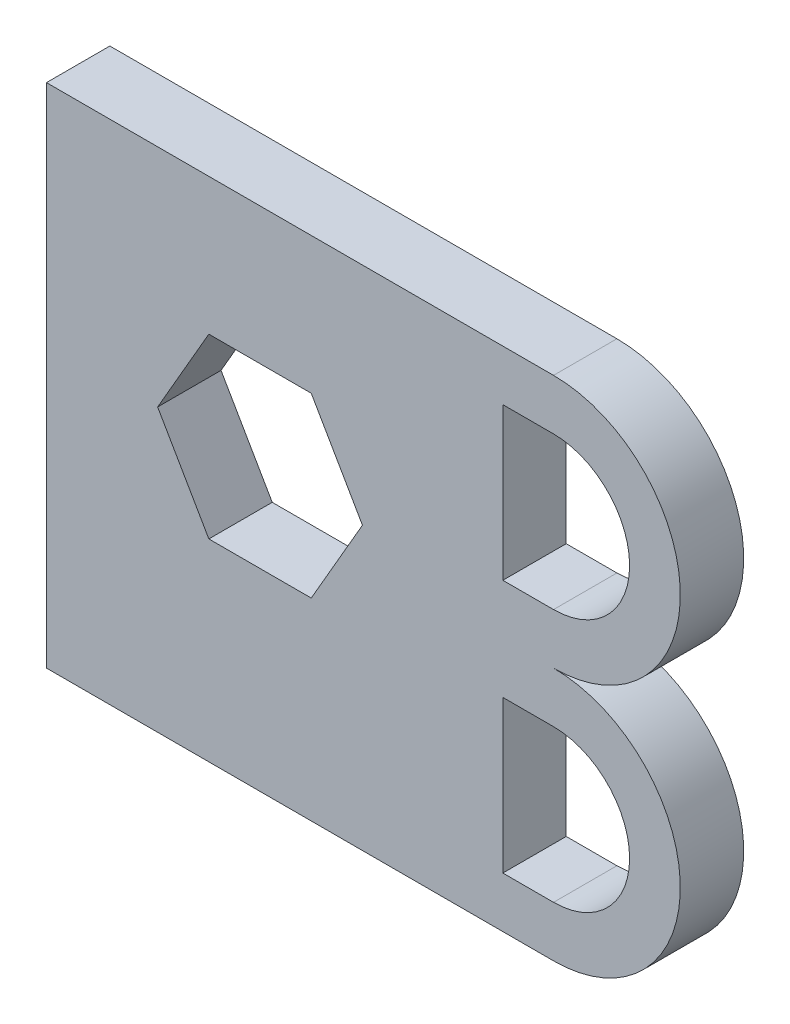
from build123d import *

# Parameters (mm, degrees)
BOSS_EXTRU_1_DEPTH      = 10
ENL_V_MAT_EXTRU_3_DEPTH = 129.452325787


with BuildPart() as part:
    # Esquisse1 → Boss.-Extru.1 (new body)
    with BuildSketch(Plane.XY):
        with BuildLine():
            Line((0, 0), (80, 0))
            ThreePointArc((80, 0), (100, 20), (80, 40))
            ThreePointArc((80, 40), (100, 60), (80, 80))
            Line((80, 80), (0, 80))
            Line((0, 80), (0, 0))
        make_face()
        with BuildLine():
            Line((72, 8), (72, 32))
            Line((72, 32), (80, 32))
            ThreePointArc((80, 32), (92, 20), (80, 8))
            Line((80, 8), (72, 8))
        make_face(mode=Mode.SUBTRACT)
        with BuildLine():
            Line((72, 48), (80, 48))
            ThreePointArc((80, 48), (92, 60), (80, 72))
            Line((80, 72), (72, 72))
            Line((72, 72), (72, 48))
        make_face(mode=Mode.SUBTRACT)
    extrude(amount=BOSS_EXTRU_1_DEPTH)

    # Esquisse2 → Enlèv. mat.-Extru.3 (cut, through all)
    with BuildSketch(Plane.XY.offset(10)):
        Polygon((49.85041269, 44.450222472), (41.772697951, 58.441234808), (25.617268474, 58.441234808), (17.539553736, 44.450222472), (25.617268474, 30.459210135), (41.772697951, 30.459210135), align=None)
    extrude(amount=-ENL_V_MAT_EXTRU_3_DEPTH, mode=Mode.SUBTRACT)


solid = part.part
